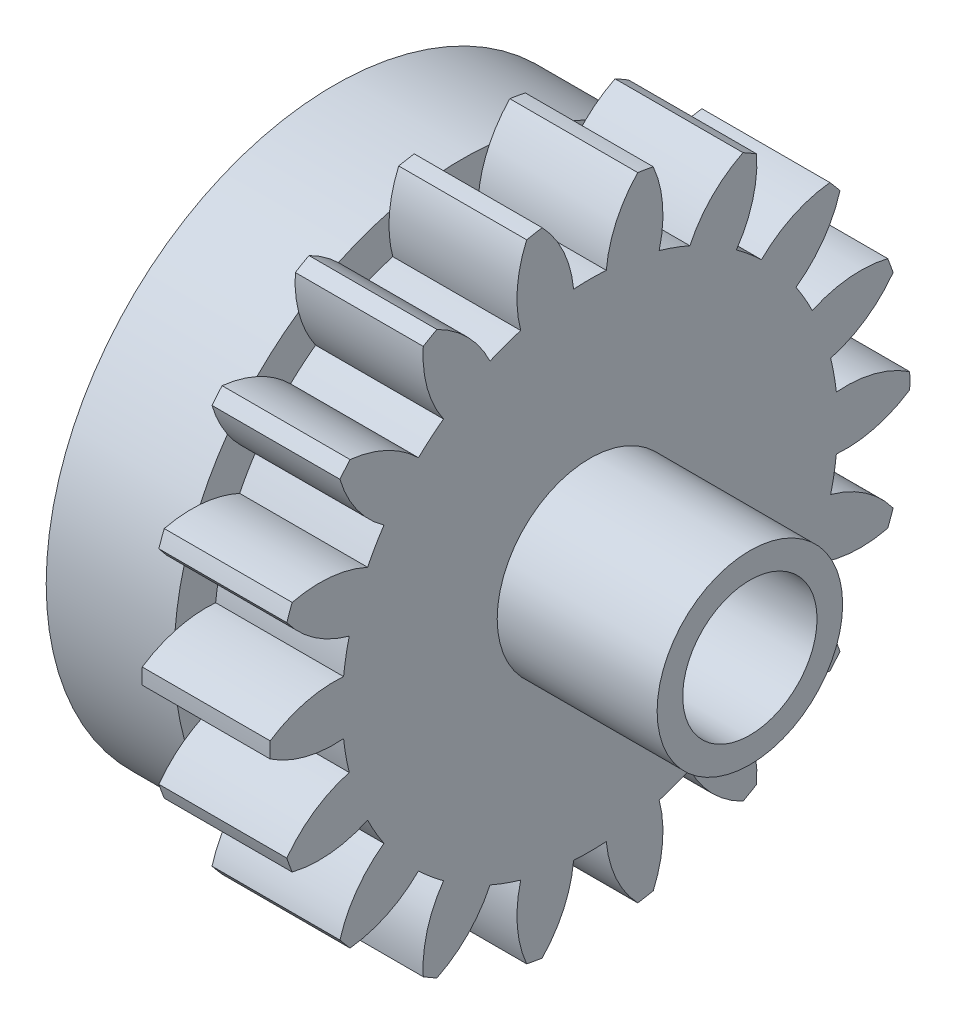
from build123d import *

# Parameters (mm, degrees)
BASPROSKE_W         = 4
BASPROSKE_H         = 10
TOOTHCUT_DEPTH      = 15.696938457
TEETHCUTS_COUNT     = 18
TEETHCUTS_ANGLE     = 340
BORSKE_R            = 2
BORE_DEPTH          = 50.0000508
SKETCH_1_R          = 9
EXTRUDE_1_DEPTH     = 4
SKETCH_2_R          = 2
CUT_EXTRUDE_1_DEPTH = 17.179282483
CUT_EXTRUDE_2_DEPTH = 3
SKETCH_6_R          = 2.9
EXTRUDE_2_DEPTH     = 5
SKETCH_7_R          = 2.1
CUT_EXTRUDE_3_DEPTH = 20.151218803


with BuildPart() as part:
    # BasProSke → Base-Revolve (revolve)
    with BuildSketch(Plane(origin=(0, 0, 0), x_dir=(1, 0, 0), z_dir=(0, 1, 0)), mode=Mode.PRIVATE) as base_revolve_sk:
        with Locations((2, 5)):
            Rectangle(BASPROSKE_W, BASPROSKE_H)
    revolve(base_revolve_sk.sketch.rotate(Axis((-10, 0, 0), (1, 0, 0)), 180), axis=Axis((-10, 0, 0), (1, 0, 0)))

    # TooCutSke → ToothCut (cut, through all)
    with BuildSketch(Plane(origin=(0, 0, 0), x_dir=(0, 0, -1), z_dir=(1, 0, 0))):
        with BuildLine():
            ThreePointArc((0.510641536, 7.732156635), (0, 7.749), (-0.510641536, 7.732156635))
            ThreePointArc((-0.510641536, 7.732156635), (-0.82619259, 8.907320741), (-1.515208602, 9.910236529))
            ThreePointArc((-1.515208602, 9.910236529), (0, 10.0254), (1.515208602, 9.910236529))
            ThreePointArc((1.515208602, 9.910236529), (0.82619259, 8.907320741), (0.510641536, 7.732156635))
        make_face()
    toothcut = extrude(amount=TOOTHCUT_DEPTH, mode=Mode.SUBTRACT)

    # TeethCuts: ToothCut ×18 about axis
    teethcuts_axis = Axis((-10, 0, 0), (1, 0, 0))
    for i in range(1, TEETHCUTS_COUNT):
        add(toothcut.rotate(teethcuts_axis, i * TEETHCUTS_ANGLE / (TEETHCUTS_COUNT - 1)), mode=Mode.SUBTRACT)

    # BorSke → Bore (cut, symmetric)
    with BuildSketch(Plane(origin=(0, 0, 0), x_dir=(0, 0, -1), z_dir=(1, 0, 0))):
        with Locations(Location((0, 0, 0), (0, 0, 180))):
            Circle(BORSKE_R)
    extrude(amount=BORE_DEPTH, both=True, mode=Mode.SUBTRACT)

    # 草图1 → 凸台-拉伸1 (add)
    with BuildSketch(Plane.ZY):
        with Locations(Location((0, 0, 0), (0, 0, 184.575164613))):
            Circle(SKETCH_1_R)
    extrude(amount=EXTRUDE_1_DEPTH)

    # 草图2 → 切除-拉伸1 (cut, through all)
    with BuildSketch(Plane.ZY.offset(4)):
        Circle(SKETCH_2_R)
    extrude(amount=-CUT_EXTRUDE_1_DEPTH, mode=Mode.SUBTRACT)

    # 草图3 → 切除-拉伸2 (cut)
    with BuildSketch(Plane.ZY.offset(4)):
        Polygon((6.2, 3.579571669), (0, 7.159143338), (-6.2, 3.579571669), (-6.2, -3.579571669), (0, -7.159143338), (6.2, -3.579571669), align=None)
    extrude(amount=-CUT_EXTRUDE_2_DEPTH, mode=Mode.SUBTRACT)

    # 草图6 → 凸台-拉伸2 (add)
    with BuildSketch(Plane(origin=(4, 0, 0), x_dir=(0, 0, -1), z_dir=(1, 0, 0))):
        with Locations(Location((0, 0, 0), (0, 0, 180))):
            Circle(SKETCH_6_R)
    extrude(amount=EXTRUDE_2_DEPTH)

    # 草图7 → 切除-拉伸3 (cut, through all)
    with BuildSketch(Plane(origin=(9, 0, 0), x_dir=(0, 0, -1), z_dir=(1, 0, 0))):
        Circle(SKETCH_7_R)
    extrude(amount=-CUT_EXTRUDE_3_DEPTH, mode=Mode.SUBTRACT)


solid = part.part
